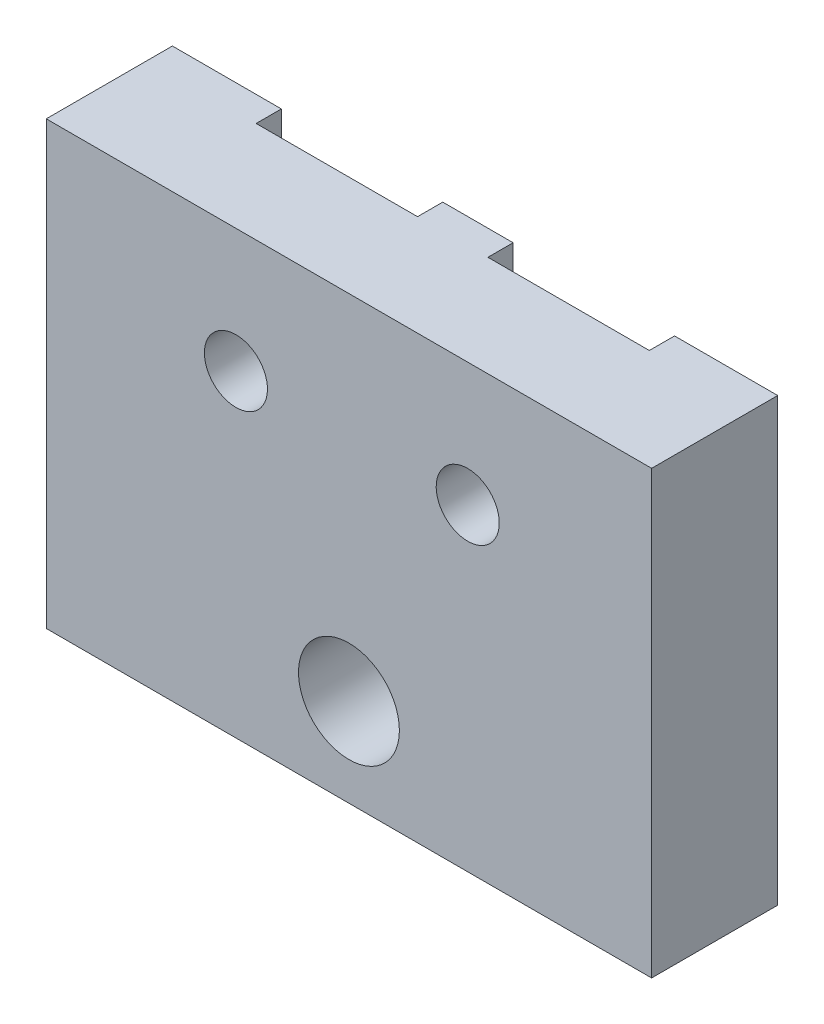
from build123d import *

# Parameters (mm, degrees)
ESQUISSE1_W             = 24
ESQUISSE1_H             = 17.5
ESQUISSE1_R             = 2
EXTRUSION1_DEPTH        = 5
ENL_V_MAT_EXTRU_2_DEPTH = 1
TROU_TARAUD_M3X0_51_D   = 2.5


with BuildPart() as part:
    # Esquisse1 → Extrusion1 (new body)
    with BuildSketch(Plane.XY):
        with Locations((0, 5.25)):
            Rectangle(ESQUISSE1_W, ESQUISSE1_H)
        Circle(ESQUISSE1_R, mode=Mode.SUBTRACT)
    extrude(amount=EXTRUSION1_DEPTH)

    # Esquisse3 → Enlèv. mat.-Extru.2 (cut)
    with BuildSketch(Plane.XY):
        with BuildLine():
            Line((-7.680232556, 24.5), (-1.280232556, 24.5))
            Line((-1.280232556, 24.5), (-1.280232556, 9.1))
            ThreePointArc((-1.280232556, 9.1), (-4.480232556, 5.9), (-7.680232556, 9.1))
            Line((-7.680232556, 9.1), (-7.680232556, 24.5))
        make_face()
        with BuildLine():
            Line((1.509125657, 9.1), (1.509125657, 24.5))
            Line((1.509125657, 24.5), (7.909125657, 24.5))
            Line((7.909125657, 24.5), (7.909125657, 9.1))
            ThreePointArc((7.909125657, 9.1), (4.709125657, 5.9), (1.509125657, 9.1))
        make_face()
    extrude(amount=ENL_V_MAT_EXTRU_2_DEPTH, mode=Mode.SUBTRACT)

    # Trou taraudé M3x0.51 (through all)
    with Locations(Plane(origin=(-4.349577812, 3.543926442, 1), x_dir=(-1, 0, 0), z_dir=(0, 0, -1))):
        with Locations((0.130654744, 5.556073558), (-9.058703469, 5.556073558)):
            Hole(TROU_TARAUD_M3X0_51_D / 2)


solid = part.part
